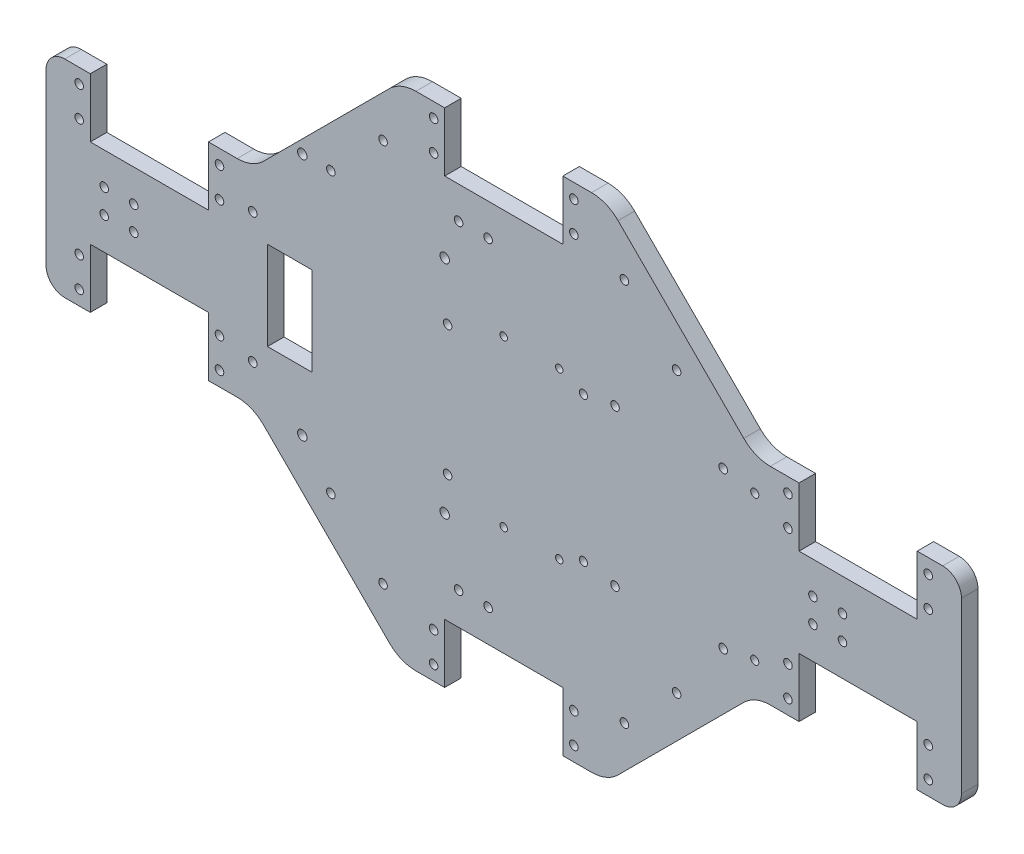
from build123d import *

# Parameters (mm, degrees)
BOSS_EXTRU_1_DEPTH       = 5.6
ENL_V_MAT_EXTRU_1_REACH  = 323.491
ESQUISSE2_W              = 40
ESQUISSE2_H              = 20
ENL_V_MAT_EXTRU_2_REACH  = 323.491
ESQUISSE3_R              = 1.45
SKETCH2_W                = 40
SKETCH2_H                = 20
CUT_EXTRUDE2_DEPTH       = 322.490839683
SKETCH5_R                = 1.45
CUT_EXTRUDE4_DEPTH       = 322.490839683
ESQUISSE4_R              = 1.375
ENL_V_MAT_EXTRU_4_DEPTH  = 322.490839683
ESQUISSE6_R              = 1.45
ENL_V_MAT_EXTRU_6_DEPTH  = 322.490839683
ESQUISSE8_R              = 1.25
ENL_V_MAT_EXTRU_7_DEPTH  = 322.490839683
ESQUISSE9_R              = 1.6
ENL_V_MAT_EXTRU_8_DEPTH  = 322.490839683
SKETCH6_W                = 15
SKETCH6_H                = 30
CUT_EXTRUDE5_DEPTH       = 10
SKETCH7_R                = 1.45
CUT_EXTRUDE6_DEPTH       = 5.6
ESQUISSE12_R             = 1.45
ENL_V_MAT_EXTRU_11_DEPTH = 322.490839683
FILLET1_R                = 6.35
FILLET2_R                = 12.7


with BuildPart() as part:
    # Esquisse1 → Boss.-Extru.1 (new body)
    with BuildSketch(Plane.XY):
        Polygon((70, -35), (120, -85), (190, -85), (240, -35), (310, -35), (310, 0), (25.838605695, 0), (0, 0), (0, -35), align=None)
    boss_extru_1 = extrude(amount=BOSS_EXTRU_1_DEPTH)

    # Esquisse2 → Enlèv. mat.-Extru.1 (cut, up to next)
    with BuildSketch(Plane.XY.offset(5.6), mode=Mode.PRIVATE) as enl_v_mat_extru_1_sk1:
        with Locations((35, -25)):
            Rectangle(ESQUISSE2_W, ESQUISSE2_H)
    enl_v_mat_extru_1_tool1 = extrude(enl_v_mat_extru_1_sk1.sketch, amount=-ENL_V_MAT_EXTRU_1_REACH, mode=Mode.PRIVATE) & part.part
    enl_v_mat_extru_1 = enl_v_mat_extru_1_tool1.solids().sort_by_distance((35, -25, 5.6))[0]
    add(enl_v_mat_extru_1, mode=Mode.SUBTRACT)

    # Esquisse3 → Enlèv. mat.-Extru.2 (cut, up to next)
    with BuildSketch(Plane.XY.offset(5.6), mode=Mode.PRIVATE) as enl_v_mat_extru_2_sk1:
        with Locations((11.25, -30.08)):
            Circle(ESQUISSE3_R)
    enl_v_mat_extru_2_tool1 = extrude(enl_v_mat_extru_2_sk1.sketch, amount=-ENL_V_MAT_EXTRU_2_REACH, mode=Mode.PRIVATE) & part.part
    # Esquisse3 → Enlèv. mat.-Extru.2 (cut, up to next)
    with BuildSketch(Plane.XY.offset(5.6), mode=Mode.PRIVATE) as enl_v_mat_extru_2_sk2:
        with Locations((58.75, -30.08)):
            Circle(ESQUISSE3_R)
    enl_v_mat_extru_2_tool2 = extrude(enl_v_mat_extru_2_sk2.sketch, amount=-ENL_V_MAT_EXTRU_2_REACH, mode=Mode.PRIVATE) & part.part
    # Esquisse3 → Enlèv. mat.-Extru.2 (cut, up to next)
    with BuildSketch(Plane.XY.offset(5.6), mode=Mode.PRIVATE) as enl_v_mat_extru_2_sk3:
        with Locations((58.75, -19.92)):
            Circle(ESQUISSE3_R)
    enl_v_mat_extru_2_tool3 = extrude(enl_v_mat_extru_2_sk3.sketch, amount=-ENL_V_MAT_EXTRU_2_REACH, mode=Mode.PRIVATE) & part.part
    # Esquisse3 → Enlèv. mat.-Extru.2 (cut, up to next)
    with BuildSketch(Plane.XY.offset(5.6), mode=Mode.PRIVATE) as enl_v_mat_extru_2_sk4:
        with Locations((11.25, -19.92)):
            Circle(ESQUISSE3_R)
    enl_v_mat_extru_2_tool4 = extrude(enl_v_mat_extru_2_sk4.sketch, amount=-ENL_V_MAT_EXTRU_2_REACH, mode=Mode.PRIVATE) & part.part
    # Esquisse3 → Enlèv. mat.-Extru.2 (cut, up to next)
    with BuildSketch(Plane.XY.offset(5.6), mode=Mode.PRIVATE) as enl_v_mat_extru_2_sk5:
        with Locations((19.712, -4.09)):
            Circle(ESQUISSE3_R)
    enl_v_mat_extru_2_tool5 = extrude(enl_v_mat_extru_2_sk5.sketch, amount=-ENL_V_MAT_EXTRU_2_REACH, mode=Mode.PRIVATE) & part.part
    # Esquisse3 → Enlèv. mat.-Extru.2 (cut, up to next)
    with BuildSketch(Plane.XY.offset(5.6), mode=Mode.PRIVATE) as enl_v_mat_extru_2_sk6:
        with Locations((29.712, -4.09)):
            Circle(ESQUISSE3_R)
    enl_v_mat_extru_2_tool6 = extrude(enl_v_mat_extru_2_sk6.sketch, amount=-ENL_V_MAT_EXTRU_2_REACH, mode=Mode.PRIVATE) & part.part
    enl_v_mat_extru_2_1 = enl_v_mat_extru_2_tool1.solids().sort_by_distance((11.25, -30.08, 5.6))[0]
    add(enl_v_mat_extru_2_1, mode=Mode.SUBTRACT)
    enl_v_mat_extru_2_2 = enl_v_mat_extru_2_tool2.solids().sort_by_distance((58.75, -30.08, 5.6))[0]
    add(enl_v_mat_extru_2_2, mode=Mode.SUBTRACT)
    enl_v_mat_extru_2_3 = enl_v_mat_extru_2_tool3.solids().sort_by_distance((58.75, -19.92, 5.6))[0]
    add(enl_v_mat_extru_2_3, mode=Mode.SUBTRACT)
    enl_v_mat_extru_2_4 = enl_v_mat_extru_2_tool4.solids().sort_by_distance((11.25, -19.92, 5.6))[0]
    add(enl_v_mat_extru_2_4, mode=Mode.SUBTRACT)
    enl_v_mat_extru_2_5 = enl_v_mat_extru_2_tool5.solids().sort_by_distance((19.712, -4.09, 5.6))[0]
    add(enl_v_mat_extru_2_5, mode=Mode.SUBTRACT)
    enl_v_mat_extru_2_6 = enl_v_mat_extru_2_tool6.solids().sort_by_distance((29.712, -4.09, 5.6))[0]
    add(enl_v_mat_extru_2_6, mode=Mode.SUBTRACT)
    enl_v_mat_extru_2 = enl_v_mat_extru_2_1 + enl_v_mat_extru_2_2 + enl_v_mat_extru_2_3 + enl_v_mat_extru_2_4 + enl_v_mat_extru_2_5 + enl_v_mat_extru_2_6  # Enlèv. mat.-Extru.2 as one shape, for the pattern or mirror that repeats it

    # Sketch2 → Cut-Extrude2 (cut, symmetric)
    with BuildSketch(Plane.XY):
        with Locations((275, -25)):
            Rectangle(SKETCH2_W, SKETCH2_H)
        with Locations((155, -75)):
            Rectangle(SKETCH2_W, SKETCH2_H)
    cut_extrude2 = extrude(amount=CUT_EXTRUDE2_DEPTH, both=True, mode=Mode.SUBTRACT)

    # Sketch5 → Cut-Extrude4 (cut, through all)
    with BuildSketch(Plane.XY):
        with Locations((131.25, -80.08)):
            Circle(SKETCH5_R)
        with Locations((178.75, -80.08)):
            Circle(SKETCH5_R)
        with Locations(Location((178.75, -69.92, 0), (0, 0, 180))):
            Circle(SKETCH5_R)
        with Locations(Location((131.25, -69.92, 0), (0, 0, 180))):
            Circle(SKETCH5_R)
        with Locations((251.25, -30.08)):
            Circle(SKETCH5_R)
        with Locations((298.75, -30.08)):
            Circle(SKETCH5_R)
        with Locations(Location((298.75, -19.92, 0), (0, 0, 180))):
            Circle(SKETCH5_R)
        with Locations(Location((251.25, -19.92, 0), (0, 0, 180))):
            Circle(SKETCH5_R)
        with Locations((139.712, -54.09)):
            Circle(SKETCH5_R)
        with Locations((149.712, -54.09)):
            Circle(SKETCH5_R)
        with Locations((259.712, -4.09)):
            Circle(SKETCH5_R)
        with Locations((269.712, -4.09)):
            Circle(SKETCH5_R)
    cut_extrude4 = extrude(amount=CUT_EXTRUDE4_DEPTH, mode=Mode.SUBTRACT)

    # Mirror1: Boss.-Extru.1, Enlèv. mat.-Extru.1, Enlèv. mat.-Extru.2, Cut-Extrude2, Cut-Extrude4 across plane
    add(boss_extru_1.mirror(Plane.ZX))
    add(enl_v_mat_extru_1.mirror(Plane.ZX), mode=Mode.SUBTRACT)
    add(enl_v_mat_extru_2.mirror(Plane.ZX), mode=Mode.SUBTRACT)
    add(cut_extrude2.mirror(Plane.ZX), mode=Mode.SUBTRACT)
    add(cut_extrude4.mirror(Plane.ZX), mode=Mode.SUBTRACT)

    # Esquisse4 → Enlèv. mat.-Extru.4 (cut, through all)
    with BuildSketch(Plane.XY.offset(5.6)):
        with Locations((182, -24.5)):
            Circle(ESQUISSE4_R)
        with Locations((240, -24.5)):
            Circle(ESQUISSE4_R)
        with Locations((240, 24.5)):
            Circle(ESQUISSE4_R)
        with Locations((182, 24.5)):
            Circle(ESQUISSE4_R)
    extrude(amount=-ENL_V_MAT_EXTRU_4_DEPTH, mode=Mode.SUBTRACT)

    # Esquisse6 → Enlèv. mat.-Extru.6 (cut, through all)
    with BuildSketch(Plane(origin=(0, 0, 0), x_dir=(-1, 0, 0), z_dir=(0, 0, -1))):
        with Locations((-192.685, -26.415)):
            Circle(ESQUISSE6_R)
        with Locations((-229.315, -26.415)):
            Circle(ESQUISSE6_R)
        with Locations((-229.315, 26.415)):
            Circle(ESQUISSE6_R)
        with Locations((-192.685, 26.415)):
            Circle(ESQUISSE6_R)
    extrude(amount=-ENL_V_MAT_EXTRU_6_DEPTH, mode=Mode.SUBTRACT)

    # Esquisse8 → Enlèv. mat.-Extru.7 (cut, through all)
    with BuildSketch(Plane(origin=(0, 0, 0), x_dir=(-1, 0, 0), z_dir=(0, 0, -1))):
        with Locations((-155, 27.95)):
            Circle(ESQUISSE8_R)
        with Locations((-173.8, 27.95)):
            Circle(ESQUISSE8_R)
        with Locations((-173.8, -27.95)):
            Circle(ESQUISSE8_R)
        with Locations((-155, -27.95)):
            Circle(ESQUISSE8_R)
    extrude(amount=-ENL_V_MAT_EXTRU_7_DEPTH, mode=Mode.SUBTRACT)

    # Esquisse9 → Enlèv. mat.-Extru.8 (cut, through all)
    with BuildSketch(Plane(origin=(0, 0, 0), x_dir=(-1, 0, 0), z_dir=(0, 0, -1))):
        with Locations((-135, -33.88)):
            Circle(ESQUISSE9_R)
        with Locations((-86.78, -35.11)):
            Circle(ESQUISSE9_R)
        with Locations((-86.78, 47.36)):
            Circle(ESQUISSE9_R)
        with Locations((-135, 41)):
            Circle(ESQUISSE9_R)
    extrude(amount=-ENL_V_MAT_EXTRU_8_DEPTH, mode=Mode.SUBTRACT)

    # Sketch6 → Cut-Extrude5 (cut)
    with BuildSketch(Plane.XY.offset(5.6)):
        with Locations((82.5, 0)):
            Rectangle(SKETCH6_W, SKETCH6_H)
    extrude(amount=-CUT_EXTRUDE5_DEPTH, mode=Mode.SUBTRACT)

    # Sketch7 → Cut-Extrude6 (cut)
    with BuildSketch(Plane(origin=(0, 0, 0), x_dir=(-1, 0, 0), z_dir=(0, 0, -1))):
        with Locations((-70, -22)):
            Circle(SKETCH7_R)
        with Locations((-136, -22)):
            Circle(SKETCH7_R)
        with Locations((-136, 22)):
            Circle(SKETCH7_R)
        with Locations((-70, 22)):
            Circle(SKETCH7_R)
    extrude(amount=-CUT_EXTRUDE6_DEPTH, mode=Mode.SUBTRACT)

    # Esquisse12 → Enlèv. mat.-Extru.11 (cut, through all)
    with BuildSketch(Plane.XY.offset(5.6)):
        with Locations((114.142135624, 65)):
            Circle(ESQUISSE12_R)
        with Locations((96.464466094, 47.32233047)):
            Circle(ESQUISSE12_R)
        with Locations(Location((213.535533906, 47.32233047, 0), (0, 0, 180))):
            Circle(ESQUISSE12_R)
        with Locations(Location((195.857864376, 65, 0), (0, 0, 180))):
            Circle(ESQUISSE12_R)
        with Locations((213.535533906, -47.32233047)):
            Circle(ESQUISSE12_R)
        with Locations((195.857864376, -65)):
            Circle(ESQUISSE12_R)
        with Locations(Location((114.142135624, -65, 0), (0, 0, 180))):
            Circle(ESQUISSE12_R)
        with Locations(Location((96.464466094, -47.32233047, 0), (0, 0, 180))):
            Circle(ESQUISSE12_R)
    extrude(amount=-ENL_V_MAT_EXTRU_11_DEPTH, mode=Mode.SUBTRACT)

    # Fillet1
    fillet1_edges = [part.edges().sort_by_distance(p)[0] for p in [
        (0, 35, 2.8),
        (310, 35, 2.8),
        (0, -35, 2.8),
        (310, -35, 2.8),
    ]]
    fillet(fillet1_edges, radius=FILLET1_R)

    # Fillet2
    fillet2_edges = [part.edges().sort_by_distance(p)[0] for p in [
        (70, 35, 2.8),
        (240, 35, 2.8),
        (190, 85, 2.8),
        (120, 85, 2.8),
        (240, -35, 2.8),
        (190, -85, 2.8),
        (120, -85, 2.8),
        (70, -35, 2.8),
    ]]
    fillet(fillet2_edges, radius=FILLET2_R)


solid = part.part
